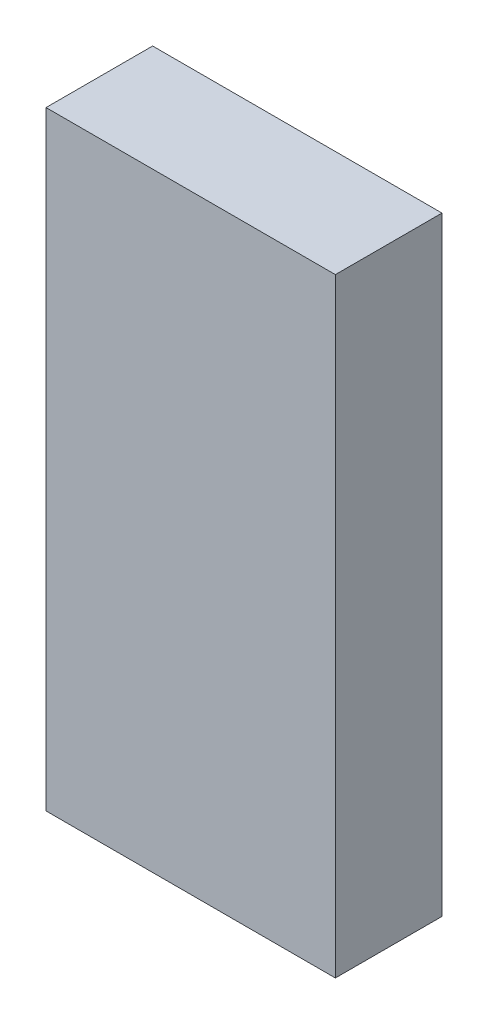
from build123d import *

# Parameters (mm, degrees)
SKETCH1_W           = 19
SKETCH1_H           = 40
BOSS_EXTRUDE1_DEPTH = 7


with BuildPart() as part:
    # Sketch1 → Boss-Extrude1 (new body)
    with BuildSketch(Plane.XY):
        Rectangle(SKETCH1_W, SKETCH1_H)
    extrude(amount=BOSS_EXTRUDE1_DEPTH)


solid = part.part
